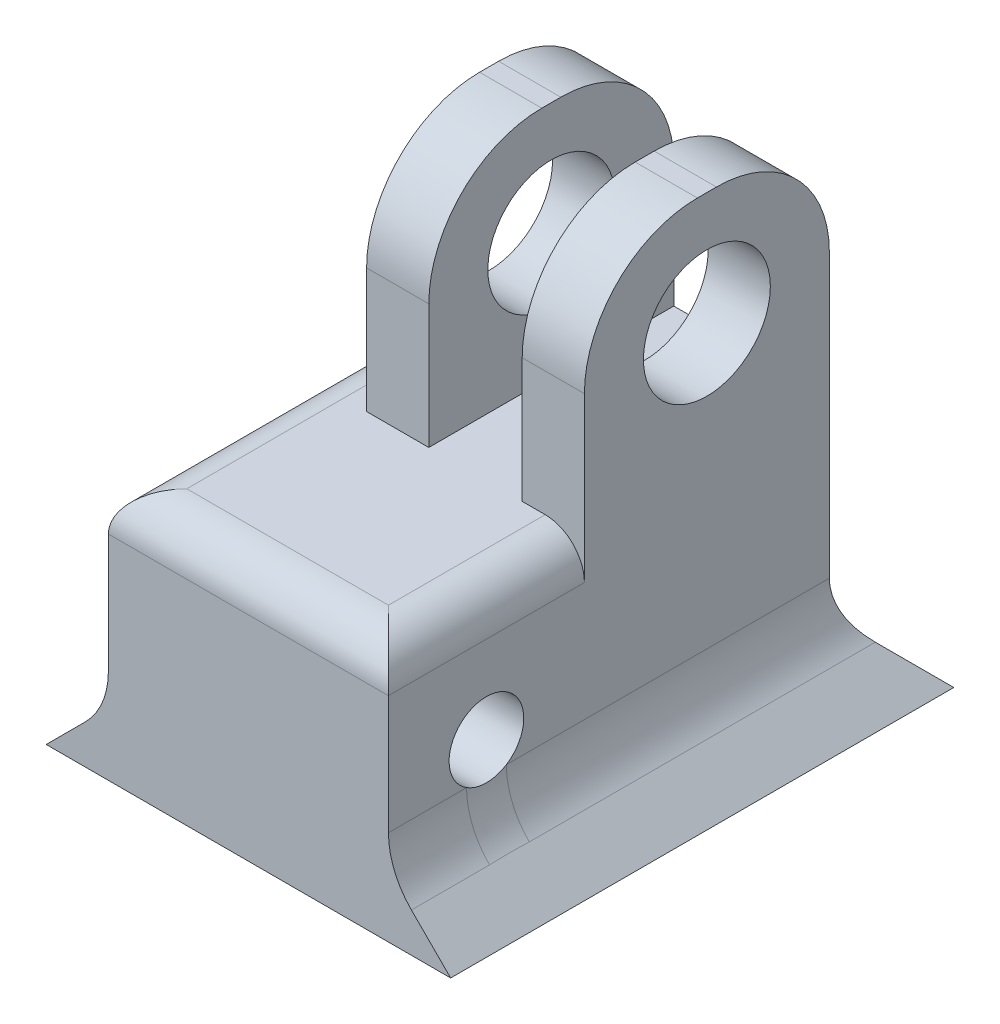
from build123d import *

# Parameters (mm, degrees)
SKETCH1_W                       = 28.58
SKETCH1_H                       = 50
BOSS_EXTRUDE1_DEPTH             = 12.5
SKETCH2_W                       = 9.53
SKETCH2_H                       = 24.225
SKETCH2_W_2                     = 6.35
CUT_EXTRUDE1_DEPTH              = 39.134028111
FILLET1_R                       = 11.53
SKETCH3_R                       = 6.477
CUT_EXTRUDE2_DEPTH              = 40.975822693
BOSS_EXTRUDE2_DEPTH             = 28.58
SKETCH5_W                       = 28.58
SKETCH5_H                       = 25.775
BOSS_EXTRUDE3_DEPTH             = 20
CUT_EXTRUDE3_DEPTH              = 50.98066026
CUT_EXTRUDE3_DEPTH_BACK         = 50.98066026
SKETCH6_R                       = 3.81
BOSS_EXTRUDE4_REACH             = 55.425
BOSS_EXTRUDE4_DIRECTION_2_REACH = 55.425
F_5_0MM_DOWEL_HOLE1_D           = 5
F_5_0MM_DOWEL_HOLE1_DEPTH       = 10
F_5_0MM_DOWEL_HOLE1_TIP         = 1.502151548
FILLET2_R                       = 8
FILLET4_R                       = 4


with BuildPart() as part:
    # Sketch1 → Boss-Extrude1 (new, symmetric)
    with BuildSketch(Plane.XY):
        Rectangle(SKETCH1_W, SKETCH1_H)
    extrude(amount=BOSS_EXTRUDE1_DEPTH, both=True)

    # Sketch2 → Cut-Extrude1 (cut, through all)
    with BuildSketch(Plane(origin=(0, 0, 12.5), x_dir=(-1, 0, 0), z_dir=(0, 0, 1))):
        with Locations((-3.175, -12.8875)):
            Rectangle(SKETCH2_W, SKETCH2_H)
        with Locations((11.115, -12.8875)):
            Rectangle(SKETCH2_W_2, SKETCH2_H)
    extrude(amount=-CUT_EXTRUDE1_DEPTH, mode=Mode.SUBTRACT)

    # Fillet1
    fillet1_edges = [part.edges().sort_by_distance(p)[0] for p in [
        (-4.765, 25, -12.5),
        (-4.765, 25, 12.5),
        (11.115, 25, -12.5),
        (11.115, 25, 12.5),
    ]]
    fillet(fillet1_edges, radius=FILLET1_R)

    # Sketch3 → Cut-Extrude2 (cut, through all)
    with BuildSketch(Plane(origin=(14.29, 0, 0), x_dir=(0, 0, -1), z_dir=(1, 0, 0))):
        with Locations(Location((0, 13.47, 0), (0, 0, 270))):
            Circle(SKETCH3_R)
    extrude(amount=-CUT_EXTRUDE2_DEPTH, mode=Mode.SUBTRACT)

    # Sketch4 → Boss-Extrude2 (add)
    with BuildSketch(Plane(origin=(14.29, 0, 0), x_dir=(0, 0, -1), z_dir=(1, 0, 0))):
        Polygon((18.85, -25), (12.5, -18.65), (12.5, -25), align=None)
    extrude(amount=-BOSS_EXTRUDE2_DEPTH)

    # Sketch5 → Boss-Extrude3 (add)
    with BuildSketch(Plane.XY.offset(12.5)):
        with Locations((0, -12.1125)):
            Rectangle(SKETCH5_W, SKETCH5_H)
    extrude(amount=BOSS_EXTRUDE3_DEPTH)

    # Sketch6 → Cut-Extrude3 (cut, two sides: drawn at the far end of the back side and taken through both)
    with BuildSketch(Plane(origin=(14.29, 0, 0), x_dir=(0, 0, -1), z_dir=(1, 0, 0)).offset(-CUT_EXTRUDE3_DEPTH_BACK)):
        with Locations((-22.5, -12.1125)):
            Circle(SKETCH6_R)
    extrude(amount=CUT_EXTRUDE3_DEPTH + CUT_EXTRUDE3_DEPTH_BACK, mode=Mode.SUBTRACT)

    # Boss-Extrude4: up to this face of the body (flat: up to its plane)
    boss_extrude4_end = Plane(part.part.faces().sort_by_distance((0, -12.1125, 32.5))[0])
    # Sketch7 → Boss-Extrude4 (add, up to the picked face)
    with BuildSketch(Plane(origin=(0, 0, -12.5), x_dir=(-1, 0, 0), z_dir=(0, 0, -1)), mode=Mode.PRIVATE) as boss_extrude4_sk1:
        Polygon((-14.29, -25), (-20.64, -25), (-14.29, -18.65), align=None)
    boss_extrude4_tool1 = split(extrude(boss_extrude4_sk1.sketch, amount=-BOSS_EXTRUDE4_REACH, mode=Mode.PRIVATE), bisect_by=boss_extrude4_end, keep=Keep.BOTH, mode=Mode.PRIVATE)
    boss_extrude4 = boss_extrude4_tool1.solids().sort_by(Axis((16.406667, -22.883333, -12.5), (0, 0, 1)))[0]
    add(boss_extrude4)

    # Boss-Extrude4 direction 2: up to this face of the body (flat: up to its plane)
    boss_extrude4_direction_2_end = Plane(part.part.faces().sort_by_distance((0, -21.825, -15.675))[0])
    # Sketch7 → Boss-Extrude4 direction 2 (add, up to the picked face)
    with BuildSketch(Plane(origin=(0, 0, -12.5), x_dir=(-1, 0, 0), z_dir=(0, 0, -1)), mode=Mode.PRIVATE) as boss_extrude4_direction_2_sk1:
        Polygon((-14.29, -25), (-20.64, -25), (-14.29, -18.65), align=None)
    boss_extrude4_direction_2_tool1 = split(extrude(boss_extrude4_direction_2_sk1.sketch, amount=BOSS_EXTRUDE4_DIRECTION_2_REACH, mode=Mode.PRIVATE), bisect_by=boss_extrude4_direction_2_end, keep=Keep.BOTH, mode=Mode.PRIVATE)
    boss_extrude4_direction_2 = boss_extrude4_direction_2_tool1.solids().sort_by(Axis((16.406667, -22.883333, -12.5), (0, 0, -1)))[0]
    add(boss_extrude4_direction_2)

    # Mirror2: Boss-Extrude4, Boss-Extrude4 direction 2 across plane
    add(boss_extrude4.mirror(Plane(origin=(0, 0, 0), x_dir=(0, 0, 1), z_dir=(1, 0, 0))))
    add(boss_extrude4_direction_2.mirror(Plane(origin=(0, 0, 0), x_dir=(0, 0, 1), z_dir=(1, 0, 0))))

    # Ø5.0mm Dowel Hole1
    with Locations(Plane(origin=(0, -25, 0), x_dir=(-1, 0, 0), z_dir=(0, -1, 0))):
        with Locations((-7.5, 0.534345417), (7.5, 0.534345417), (7.5, -14.465654583), (-7.5, -14.465654583)):
            Hole(F_5_0MM_DOWEL_HOLE1_D / 2, depth=F_5_0MM_DOWEL_HOLE1_DEPTH)
            with Locations((0, 0, -(F_5_0MM_DOWEL_HOLE1_DEPTH + F_5_0MM_DOWEL_HOLE1_TIP / 2))):  # 118° drill point
                Cone(0, F_5_0MM_DOWEL_HOLE1_D / 2, F_5_0MM_DOWEL_HOLE1_TIP, mode=Mode.SUBTRACT)

    # Fillet2
    fillet2_edges = [part.edges().sort_by_distance(p)[0] for p in [
        (14.29, -18.65, 10),
        (-14.29, -18.65, 10),
        (0, -18.65, -12.5),
    ]]
    fillet(fillet2_edges, radius=FILLET2_R)

    # Fillet4
    fillet4_edges = [part.edges().sort_by_distance(p)[0] for p in [
        (-14.29, 0.775, 10),
        (14.29, 0.775, 22.5),
        (0, 0.775, 32.5),
    ]]
    fillet(fillet4_edges, radius=FILLET4_R)


solid = part.part
